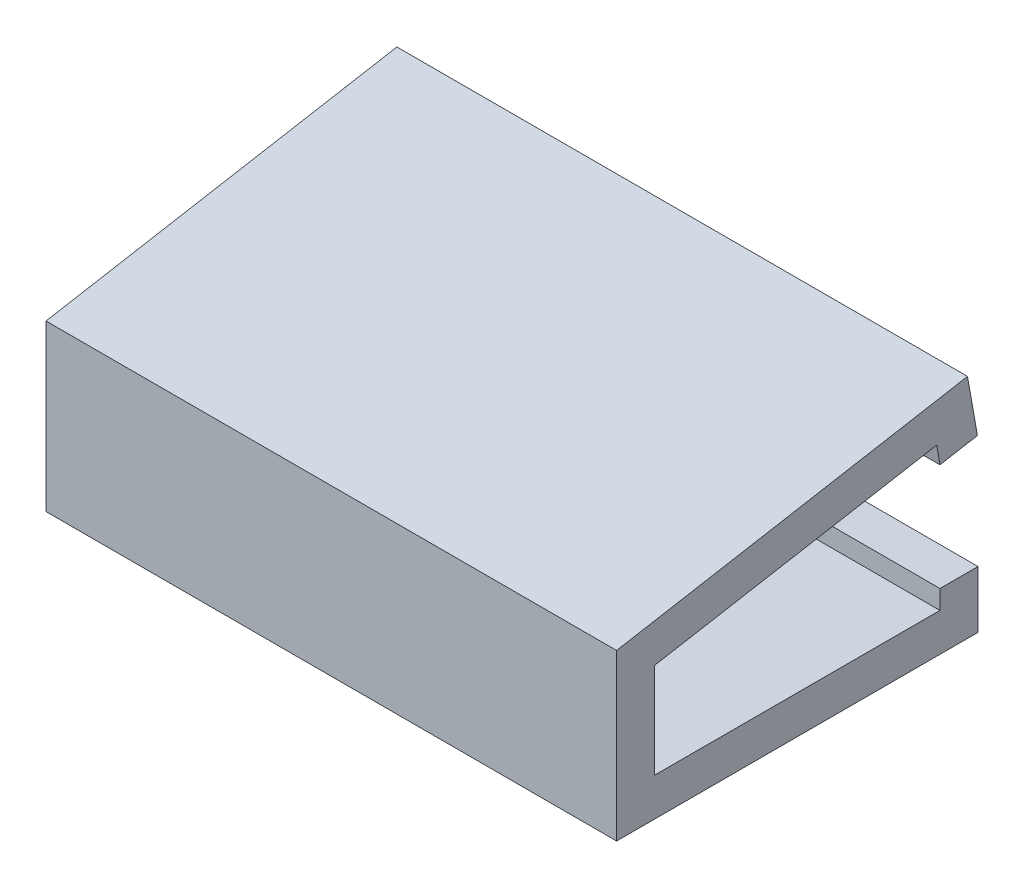
from build123d import *

# Parameters (mm, degrees)
BOSS_EXTRUDE1_DEPTH = 150


with BuildPart() as part:
    # Sketch2 → Boss-Extrude1 (new body)
    with BuildSketch(Plane(origin=(0, 0, 0), x_dir=(0, 0, -1), z_dir=(1, 0, 0))):
        Polygon((54.060266815, 3.333404374), (54.060266815, -11.666595626), (-40.939733185, -11.666595626), (-40.939733185, 31.724400686), (51.30362168, 47.98939294), (53.908344345, 33.217276645), (44.060266815, 31.480794868), (43.192025926, 36.404833633), (-30.939733185, 23.333404374), (-30.939733185, -1.666595626), (44.060266815, -1.666595626), (44.060266815, 3.333404374), align=None)
    extrude(amount=BOSS_EXTRUDE1_DEPTH)


solid = part.part
